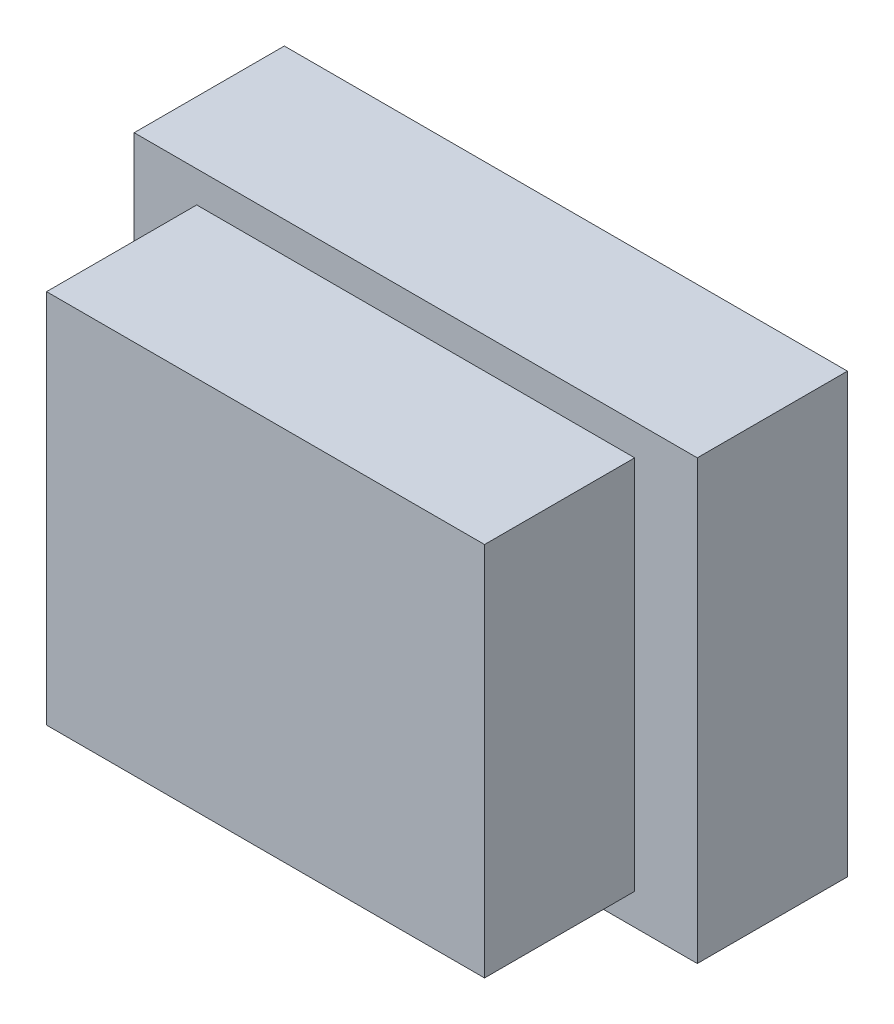
from build123d import *

# Parameters (mm, degrees)
SKETCH_1_W           = 90
SKETCH_1_H           = 70
EXTRUDE_1_DEPTH      = 48
SKETCH_2_OUTSIDE_W   = 116.742
SKETCH_2_OUTSIDE_H   = 96.742
SKETCH_2_OUTSIDE_W_2 = 70
SKETCH_2_OUTSIDE_H_2 = 60
CUT_EXTRUDE_1_DEPTH  = 24


with BuildPart() as part:
    # 草图1 → 凸台-拉伸1 (new body)
    with BuildSketch(Plane.XY):
        Rectangle(SKETCH_1_W, SKETCH_1_H)
    extrude(amount=EXTRUDE_1_DEPTH)

    # 草图2 outside → 切除-拉伸1 (cut)
    with BuildSketch(Plane.XY.offset(48)):
        Rectangle(SKETCH_2_OUTSIDE_W, SKETCH_2_OUTSIDE_H)
        Rectangle(SKETCH_2_OUTSIDE_W_2, SKETCH_2_OUTSIDE_H_2, mode=Mode.SUBTRACT)
    extrude(amount=-CUT_EXTRUDE_1_DEPTH, mode=Mode.SUBTRACT)


solid = part.part
